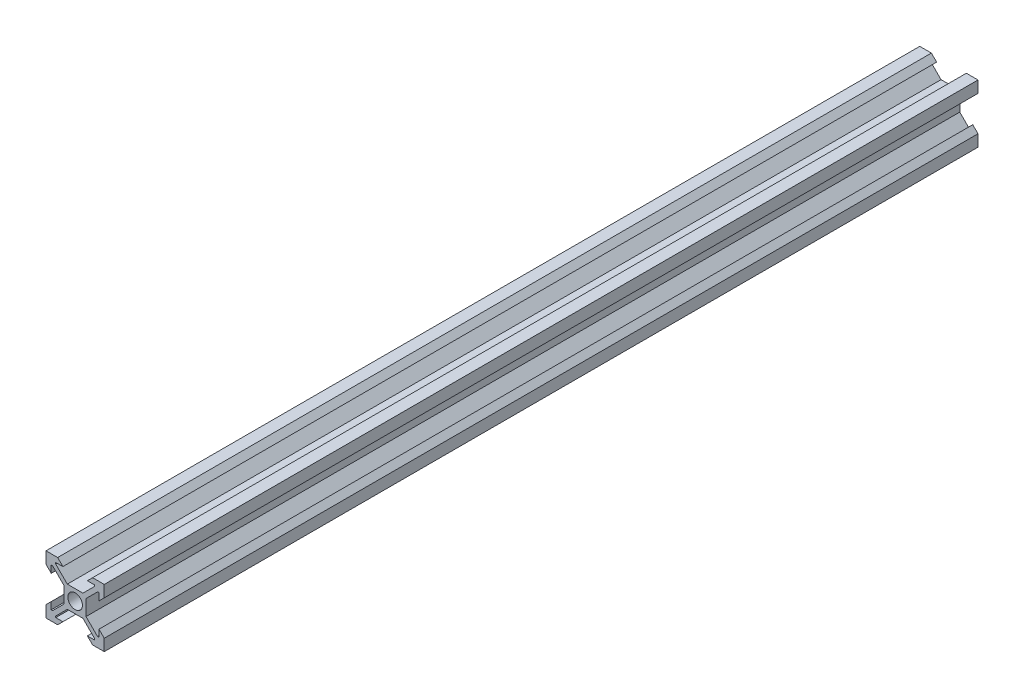
from build123d import *

# Parameters (mm, degrees)
SKETCH1_R           = 2.5
BOSS_EXTRUDE1_DEPTH = 300


with BuildPart() as part:
    # Sketch1 → Boss-Extrude1 (new body)
    with BuildSketch(Plane.XY):
        Polygon((-4.2, 8.2), (-6, 10), (-10, 10), (-10, 6), (-8.2, 4.2), (-8.2, 6.65), (-7.710660172, 6.65), (-3.744633983, 2.683973811), (-3.744633983, -2.683973811), (-7.710660172, -6.65), (-8.2, -6.65), (-8.2, -4.2), (-10, -6), (-10, -10), (-6, -10), (-4.2, -8.2), (-6.652632674, -8.2), (-6.652632674, -7.713292846), (-2.683973811, -3.744633983), (2.683973811, -3.744633983), (6.652632674, -7.713292846), (6.652632674, -8.2), (4.2, -8.2), (6, -10), (10, -10), (10, -6), (8.2, -4.2), (8.2, -6.65), (7.710660172, -6.65), (3.744633983, -2.683973811), (3.744633983, 2.683973811), (7.710660172, 6.65), (8.2, 6.65), (8.2, 4.2), (10, 6), (10, 10), (6, 10), (4.2, 8.2), (6.652632674, 8.2), (6.652632674, 7.713292846), (2.683973811, 3.744633983), (-2.683973811, 3.744633983), (-6.652632674, 7.713292846), (-6.652632674, 8.2), align=None)
        Circle(SKETCH1_R, mode=Mode.SUBTRACT)
    extrude(amount=BOSS_EXTRUDE1_DEPTH)


solid = part.part
